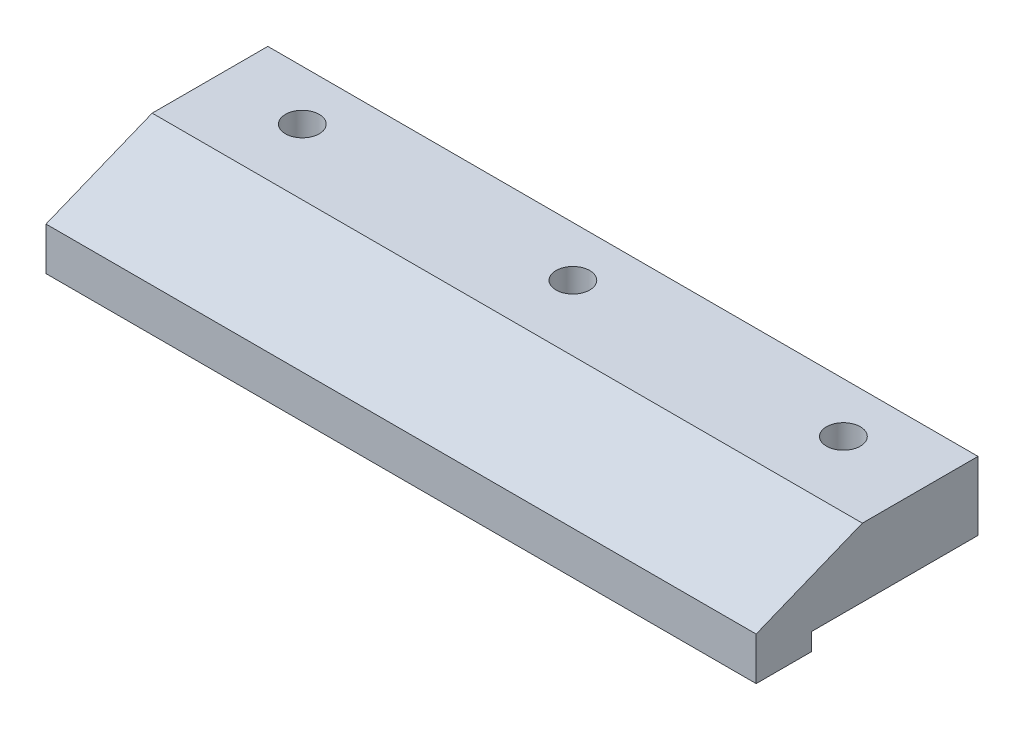
from build123d import *

# Parameters (mm, degrees)
CROQUIS1_W              = 105
CROQUIS1_H              = 50.8
SALIENTE_EXTRUIR1_DEPTH = 12.7
CROQUIS2_W              = 24.650197811
CROQUIS2_H              = 2.575416839
CORTAR_EXTRUIR1_DEPTH   = 109.772468943
CROQUIS3_R              = 2.5
CORTAR_EXTRUIR2_DEPTH   = 60.688357324


with BuildPart() as part:
    # Croquis1 → Saliente-Extruir1 (new body)
    with BuildSketch(Plane(origin=(0, 0, 0), x_dir=(1, 0, 0), z_dir=(0, 1, 0))):
        Rectangle(CROQUIS1_W, CROQUIS1_H)
    extrude(amount=SALIENTE_EXTRUIR1_DEPTH)

    # Croquis2 → Cortar-Extruir1 (cut, through all)
    with BuildSketch(Plane(origin=(52.5, 0, 0), x_dir=(0, 0, -1), z_dir=(1, 0, 0))):
        Polygon((-25.4, 6.35), (-9.701031489, 12.7), (-25.4, 12.7), align=None)
        with Locations((-4.925098905, 1.28770842)):
            Rectangle(CROQUIS2_W, CROQUIS2_H)
        Polygon((25.4, 0), (25.4, 12.7), (7.4, 12.7), (7.4, 2.575416839), (7.4, 0), align=None)
    extrude(amount=-CORTAR_EXTRUIR1_DEPTH, mode=Mode.SUBTRACT)

    # Croquis3 → Cortar-Extruir2 (cut, through all)
    with BuildSketch(Plane(origin=(0, 12.7, 0), x_dir=(1, 0, 0), z_dir=(0, 1, 0))):
        with Locations(Location((0, 0, 0), (0, 0, 270))):
            Circle(CROQUIS3_R)
        with Locations(Location((-40, 0, 0), (0, 0, 270))):
            Circle(CROQUIS3_R)
        with Locations(Location((40, 0, 0), (0, 0, 270))):
            Circle(CROQUIS3_R)
    extrude(amount=-CORTAR_EXTRUIR2_DEPTH, mode=Mode.SUBTRACT)


solid = part.part
